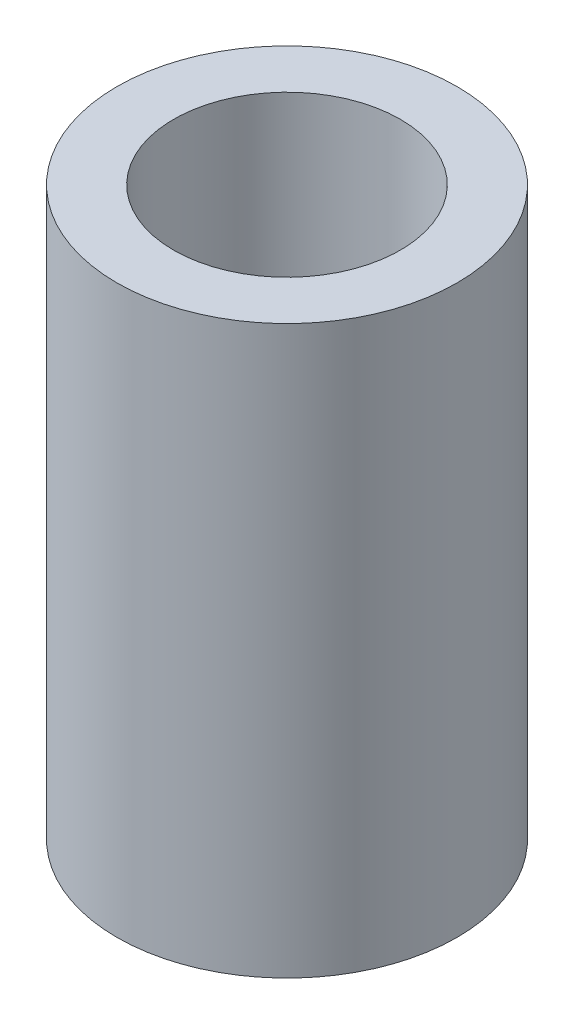
from build123d import *

# Parameters (mm, degrees)
SKETCH2_R           = 3
BOSS_EXTRUDE1_DEPTH = 10
SKETCH4_R           = 2
CUT_EXTRUDE1_DEPTH  = 114.481275989


with BuildPart() as part:
    # Sketch2 → Boss-Extrude1 (new body)
    with BuildSketch(Plane(origin=(110, 37, 0), x_dir=(1, 0, 0), z_dir=(0, 1, 0))):
        with Locations(Location((0, 0, 0), (0, 0, 270))):
            Circle(SKETCH2_R)
    extrude(amount=BOSS_EXTRUDE1_DEPTH)

    # Sketch4 → Cut-Extrude1 (cut, through all)
    with BuildSketch(Plane(origin=(0, 47, 0), x_dir=(1, 0, 0), z_dir=(0, 1, 0))):
        with Locations(Location((110, 0, 0), (0, 0, 270))):
            Circle(SKETCH4_R)
    extrude(amount=-CUT_EXTRUDE1_DEPTH, mode=Mode.SUBTRACT)


solid = part.part
